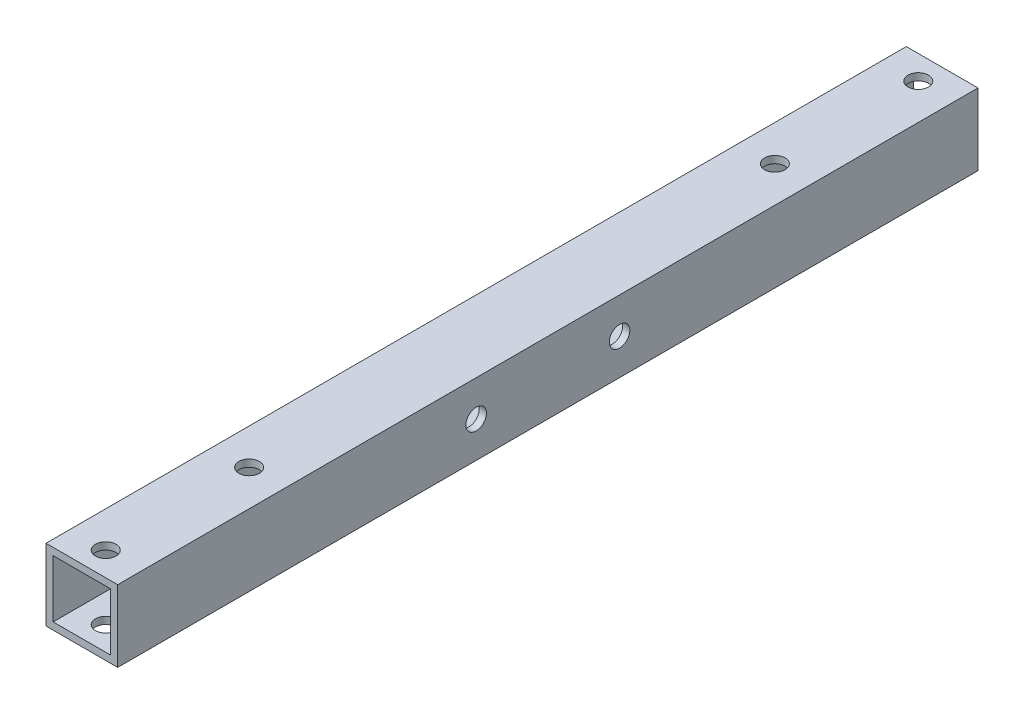
from build123d import *

# Parameters (mm, degrees)
SKETCH_1_W          = 15
SKETCH_1_H          = 15
SKETCH_1_W_2        = 12
SKETCH_1_H_2        = 12
EXTRUDE_1_DEPTH     = 180
SKETCH_3_R          = 2.15
CUT_EXTRUDE_2_DEPTH = 181.779561898
SKETCH_4_R          = 2.15
CUT_EXTRUDE_3_DEPTH = 181.779561898


with BuildPart() as part:
    # ｽｹｯﾁ1 → 押し出し-薄板1 (new body)
    with BuildSketch(Plane.XY):
        Rectangle(SKETCH_1_W, SKETCH_1_H)
        Rectangle(SKETCH_1_W_2, SKETCH_1_H_2, mode=Mode.SUBTRACT)
    extrude(amount=EXTRUDE_1_DEPTH)

    # ｽｹｯﾁ3 → ｶｯﾄ - 押し出し2 (cut, through all)
    with BuildSketch(Plane(origin=(7.5, 0, 0), x_dir=(0, 0, -1), z_dir=(1, 0, 0))):
        with Locations((-75, 0)):
            Circle(SKETCH_3_R)
        with Locations((-105, 0)):
            Circle(SKETCH_3_R)
    extrude(amount=-CUT_EXTRUDE_2_DEPTH, mode=Mode.SUBTRACT)

    # ｽｹｯﾁ4 → ｶｯﾄ - 押し出し3 (cut, through all)
    with BuildSketch(Plane(origin=(0, 7.5, 0), x_dir=(1, 0, 0), z_dir=(0, 1, 0))):
        with Locations(Location((0, -5, 0), (0, 0, 270))):
            Circle(SKETCH_4_R)
        with Locations(Location((0, -35, 0), (0, 0, 270))):
            Circle(SKETCH_4_R)
        with Locations(Location((0, -175, 0), (0, 0, 270))):
            Circle(SKETCH_4_R)
        with Locations(Location((0, -145, 0), (0, 0, 270))):
            Circle(SKETCH_4_R)
    extrude(amount=-CUT_EXTRUDE_3_DEPTH, mode=Mode.SUBTRACT)


solid = part.part
